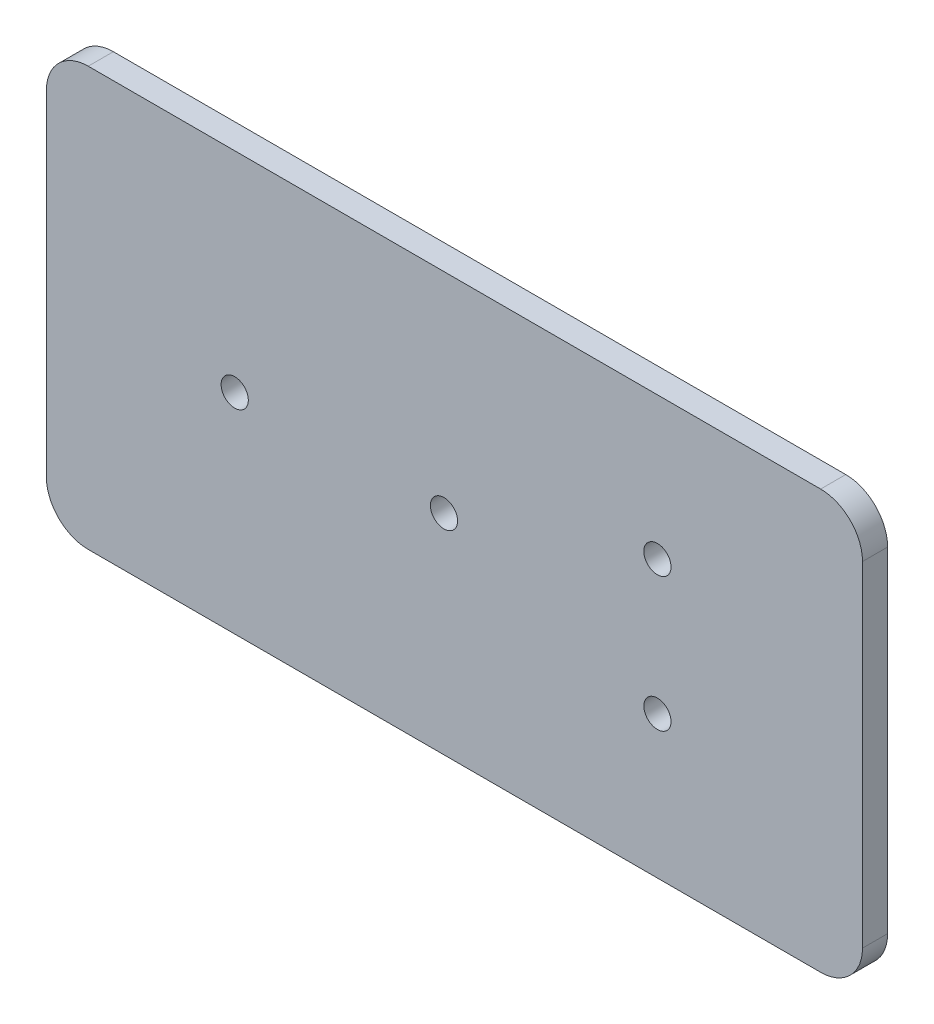
from build123d import *

# Parameters (mm, degrees)
SKETCH1_W           = 195
SKETCH1_H           = 100
SKETCH1_R           = 3.25
BOSS_EXTRUDE1_DEPTH = 6
FILLET1_R           = 10


with BuildPart() as part:
    # Sketch1 → Boss-Extrude1 (new body)
    with BuildSketch(Plane.XY.offset(5)):
        with Locations((4.617235872, -10.483294202)):
            Rectangle(SKETCH1_W, SKETCH1_H)
        with Locations((53.117235872, 5.516705798)):
            Circle(SKETCH1_R, mode=Mode.SUBTRACT)
        with Locations((53.117235872, -26.483294202)):
            Circle(SKETCH1_R, mode=Mode.SUBTRACT)
        with Locations((2.117235872, -10.483294202)):
            Circle(SKETCH1_R, mode=Mode.SUBTRACT)
        with Locations((-47.882764128, -10.483294202)):
            Circle(SKETCH1_R, mode=Mode.SUBTRACT)
    extrude(amount=-BOSS_EXTRUDE1_DEPTH)

    # Fillet1
    fillet1_edges = [part.edges().sort_by_distance(p)[0] for p in [
        (-92.882764128, -60.483294202, 2),
        (-92.882764128, 39.516705798, 2),
        (102.117235872, 39.516705798, 2),
        (102.117235872, -60.483294202, 2),
    ]]
    fillet(fillet1_edges, radius=FILLET1_R)


solid = part.part
